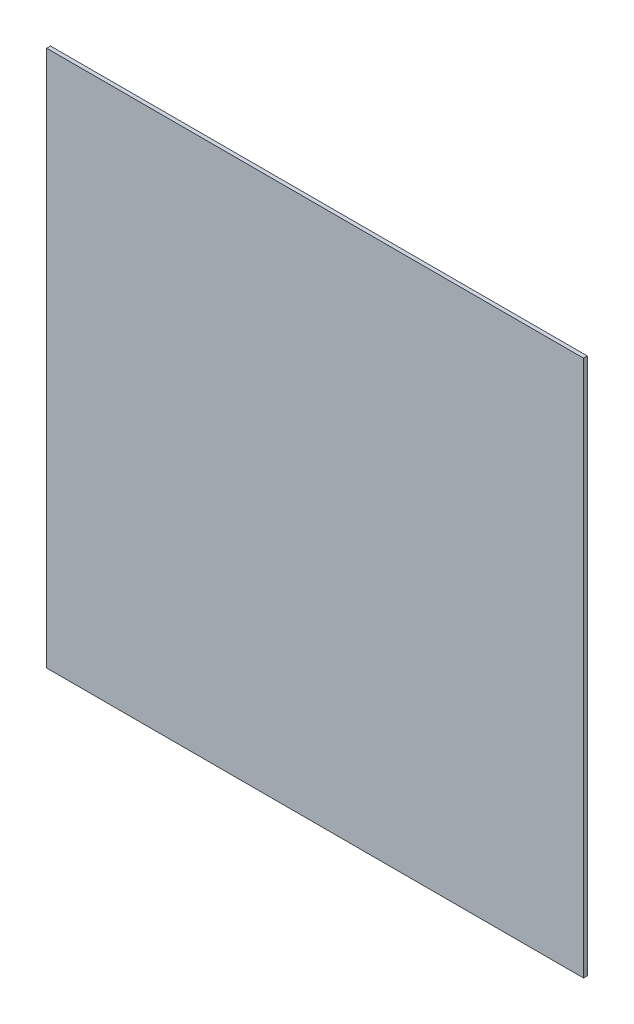
from build123d import *

# Parameters (mm, degrees)
SKETCH_1_W      = 420
SKETCH_1_H      = 420
EXTRUDE_1_DEPTH = 3


with BuildPart() as part:
    # 草图1 → 凸台-拉伸1 (new body)
    with BuildSketch(Plane.XY):
        Rectangle(SKETCH_1_W, SKETCH_1_H)
    extrude(amount=EXTRUDE_1_DEPTH)


solid = part.part
